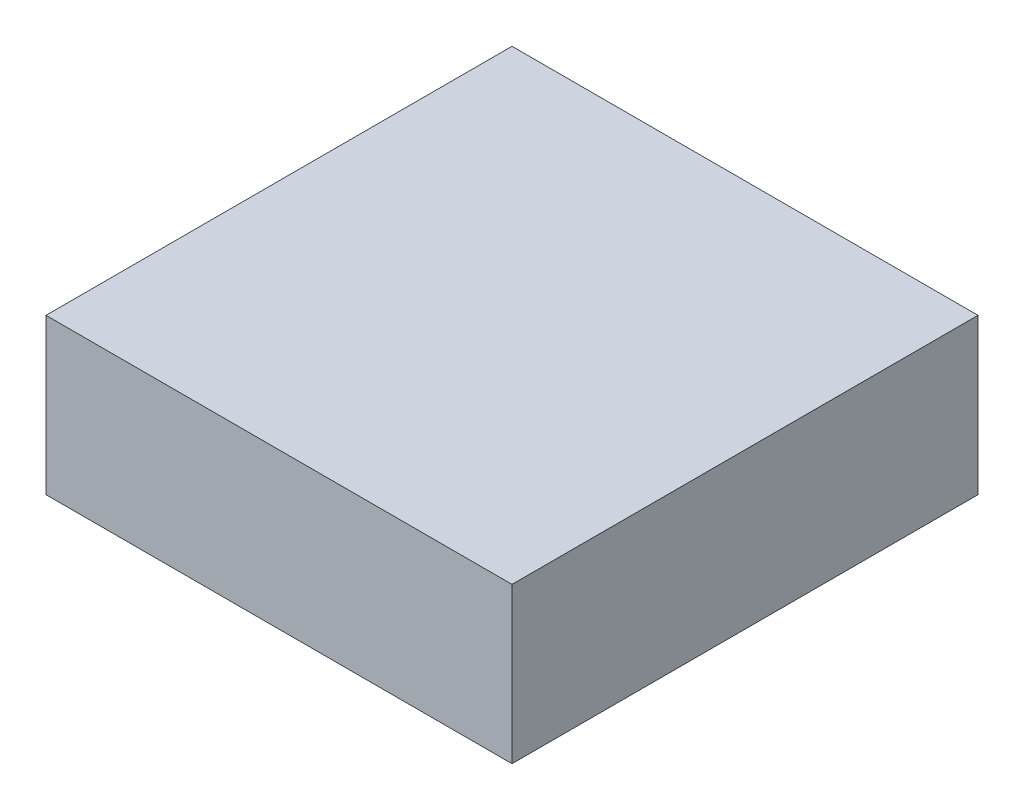
from build123d import *

# Parameters (mm, degrees)
SKETCH_1_W      = 90
SKETCH_1_H      = 90
EXTRUDE_1_DEPTH = 30


with BuildPart() as part:
    # 草图1 → 凸台-拉伸1 (new body)
    with BuildSketch(Plane(origin=(0, 0, 0), x_dir=(1, 0, 0), z_dir=(0, 1, 0))):
        with Locations((41.666666667, 35)):
            Rectangle(SKETCH_1_W, SKETCH_1_H)
    extrude(amount=EXTRUDE_1_DEPTH)


solid = part.part
